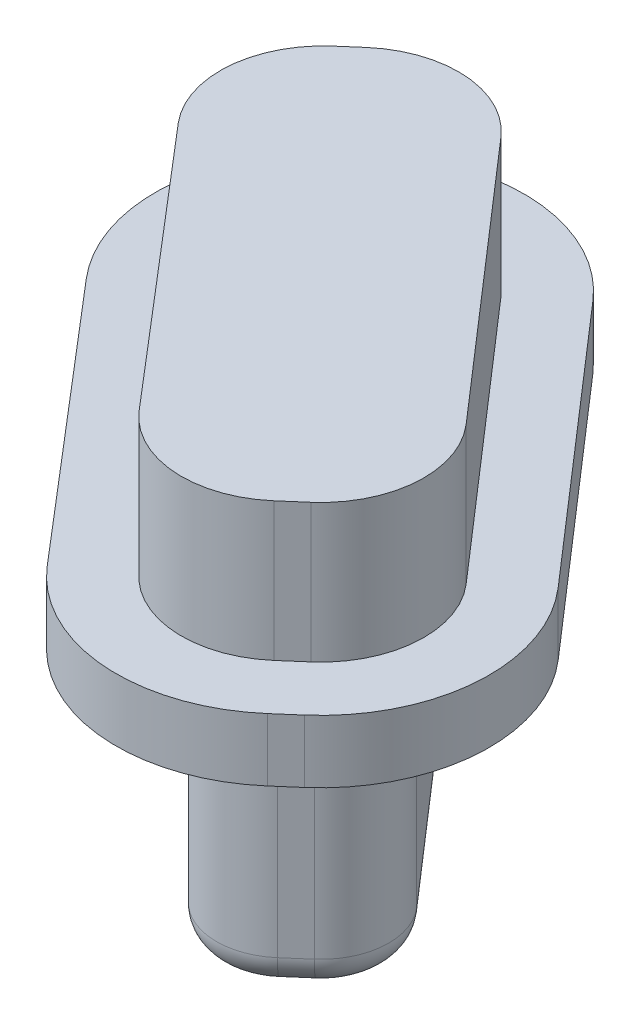
from build123d import *

# Parameters (mm, degrees)
BOSS_EXTRUDE1_DEPTH = 7
BOSS_EXTRUDE3_START = 3.175
BOSS_EXTRUDE3_DEPTH = 3.175
BOSS_EXTRUDE4_DEPTH = 12.7
FILLET2_R           = 1.5875


with BuildPart() as part:
    # Sketch1 → Boss-Extrude1 (new body)
    # profile 1 of 2: a face of its own
    with BuildSketch(Plane(origin=(0, 0, 0), x_dir=(1, 0, 0), z_dir=(0, 1, 0))):
        with BuildLine():
            Line((-397.046660629, -66.449724392), (-396.047807587, -65.58143469))
            ThreePointArc((-396.047807587, -65.58143469), (-394.269590942, -62.014883864), (-395.534134167, -58.235562542))
            Line((-395.534134167, -58.235562542), (-407.251348425, -44.756449439))
            ThreePointArc((-407.251348425, -44.756449439), (-410.81789925, -42.978232793), (-414.597220573, -44.242776019))
            Line((-414.597220573, -44.242776019), (-415.480745161, -45.010812225))
            ThreePointArc((-415.480745161, -45.010812225), (-417.25736044, -48.555145476), (-416.023502117, -52.322937096))
            Line((-416.023502117, -52.322937096), (-404.421616313, -65.902303694))
            ThreePointArc((-404.421616313, -65.902303694), (-400.848199526, -67.712666251), (-397.046660629, -66.449724392))
        make_face()
        with BuildLine():
            ThreePointArc((-396.131127084, -65.485586573), (-394.396281576, -62.006024792), (-395.629982284, -58.318882038))
            Line((-395.629982284, -58.318882038), (-407.347196542, -44.839768935))
            ThreePointArc((-407.347196542, -44.839768935), (-410.826758322, -43.104923427), (-414.513901076, -44.338624135))
            Line((-414.513901076, -44.338624135), (-415.397425664, -45.106660342))
            ThreePointArc((-415.397425664, -45.106660342), (-417.130708863, -48.564546441), (-415.926944646, -52.240440703))
            Line((-415.926944646, -52.240440703), (-404.325058842, -65.819807301))
            ThreePointArc((-404.325058842, -65.819807301), (-400.838798562, -67.586014674), (-397.129980126, -66.353876275))
            Line((-397.129980126, -66.353876275), (-396.131127084, -65.485586573))
        make_face(mode=Mode.SUBTRACT)
    # profile 2 of 2: a face of its own
    with BuildSketch(Plane(origin=(0, 0, 0), x_dir=(1, 0, 0), z_dir=(0, 1, 0))):
        with BuildLine():
            Line((-397.129980126, -66.353876275), (-396.131127084, -65.485586573))
            ThreePointArc((-396.131127084, -65.485586573), (-394.396281576, -62.006024792), (-395.629982284, -58.318882038))
            Line((-395.629982284, -58.318882038), (-407.347196542, -44.839768935))
            ThreePointArc((-407.347196542, -44.839768935), (-410.826758322, -43.104923427), (-414.513901076, -44.338624135))
            Line((-414.513901076, -44.338624135), (-415.397425664, -45.106660342))
            ThreePointArc((-415.397425664, -45.106660342), (-417.130708863, -48.564546441), (-415.926944646, -52.240440703))
            Line((-415.926944646, -52.240440703), (-404.325058842, -65.819807301))
            ThreePointArc((-404.325058842, -65.819807301), (-400.838798562, -67.586014674), (-397.129980126, -66.353876275))
        make_face()
    extrude(amount=BOSS_EXTRUDE1_DEPTH)

    # Sketch3 → Boss-Extrude3 (add)
    # profile 1 of 2: a face of its own
    with BuildSketch(Plane.XZ.offset(BOSS_EXTRUDE3_START)):
        with BuildLine():
            Line((-393.881500674, 68.073485724), (-394.880353715, 68.941775426))
            ThreePointArc((-394.880353715, 68.941775426), (-401.092624596, 71.005607244), (-406.932110565, 68.047209895))
            Line((-406.932110565, 68.047209895), (-418.533996369, 54.467843297))
            ThreePointArc((-418.533996369, 54.467843297), (-420.550301433, 48.310720407), (-417.647052074, 42.518761191))
            Line((-417.647052074, 42.518761191), (-416.763527487, 41.750724985))
            ThreePointArc((-416.763527487, 41.750724985), (-410.587563374, 39.684276299), (-404.759297391, 42.590142525))
            Line((-404.759297391, 42.590142525), (-393.042083133, 56.069255628))
            ThreePointArc((-393.042083133, 56.069255628), (-390.975634448, 62.245219741), (-393.881500674, 68.073485724))
        make_face()
        with BuildLine():
            Line((-396.047807587, 65.58143469), (-397.046660629, 66.449724392))
            ThreePointArc((-397.046660629, 66.449724392), (-400.848199526, 67.712666251), (-404.421616313, 65.902303694))
            Line((-404.421616313, 65.902303694), (-416.023502117, 52.322937096))
            ThreePointArc((-416.023502117, 52.322937096), (-417.25736044, 48.555145476), (-415.480745161, 45.010812225))
            Line((-415.480745161, 45.010812225), (-414.597220573, 44.242776019))
            ThreePointArc((-414.597220573, 44.242776019), (-410.81789925, 42.978232793), (-407.251348425, 44.756449439))
            Line((-407.251348425, 44.756449439), (-395.534134167, 58.235562542))
            ThreePointArc((-395.534134167, 58.235562542), (-394.269590942, 62.014883864), (-396.047807587, 65.58143469))
        make_face(mode=Mode.SUBTRACT)
    # profile 2 of 2: a face of its own
    with BuildSketch(Plane.XZ.offset(BOSS_EXTRUDE3_START)):
        with BuildLine():
            ThreePointArc((-395.534134167, 58.235562542), (-394.269590942, 62.014883864), (-396.047807587, 65.58143469))
            Line((-396.047807587, 65.58143469), (-397.046660629, 66.449724392))
            ThreePointArc((-397.046660629, 66.449724392), (-400.848199526, 67.712666251), (-404.421616313, 65.902303694))
            Line((-404.421616313, 65.902303694), (-416.023502117, 52.322937096))
            ThreePointArc((-416.023502117, 52.322937096), (-417.25736044, 48.555145476), (-415.480745161, 45.010812225))
            Line((-415.480745161, 45.010812225), (-414.597220573, 44.242776019))
            ThreePointArc((-414.597220573, 44.242776019), (-410.81789925, 42.978232793), (-407.251348425, 44.756449439))
            Line((-407.251348425, 44.756449439), (-395.534134167, 58.235562542))
        make_face()
    extrude(amount=-BOSS_EXTRUDE3_DEPTH)

    # Sketch4 → Boss-Extrude4 (add)
    with BuildSketch(Plane.XZ.offset(3.175)):
        with BuildLine():
            Line((-397.214280541, 64.239561056), (-398.213133583, 65.107850758))
            ThreePointArc((-398.213133583, 65.107850758), (-400.716586027, 65.939544178), (-403.069811716, 64.747354201))
            Line((-403.069811716, 64.747354201), (-414.67169752, 51.167987603))
            ThreePointArc((-414.67169752, 51.167987603), (-415.484238367, 48.686758975), (-414.314272207, 46.352685859))
            Line((-414.314272207, 46.352685859), (-413.430747619, 45.584649652))
            ThreePointArc((-413.430747619, 45.584649652), (-410.941926261, 44.751901674), (-408.593222058, 45.922922392))
            Line((-408.593222058, 45.922922392), (-396.876007801, 59.402035495))
            ThreePointArc((-396.876007801, 59.402035495), (-396.043259823, 61.890856854), (-397.214280541, 64.239561056))
        make_face()
    extrude(amount=BOSS_EXTRUDE4_DEPTH)

    # Fillet2
    fillet2_edges = [part.edges().sort_by_distance(p)[0] for p in [
        (-397.713707062, -15.875, 64.673705907),
        (-400.716586027, -15.875, 65.939544178),
        (-408.870754618, -15.875, 57.957670902),
        (-415.484238367, -15.875, 48.686758975),
        (-413.872509913, -15.875, 45.968667755),
        (-410.941926261, -15.875, 44.751901674),
        (-402.73461493, -15.875, 52.662478944),
        (-396.043259823, -15.875, 61.890856854),
    ]]
    fillet(fillet2_edges, radius=FILLET2_R)


solid = part.part
